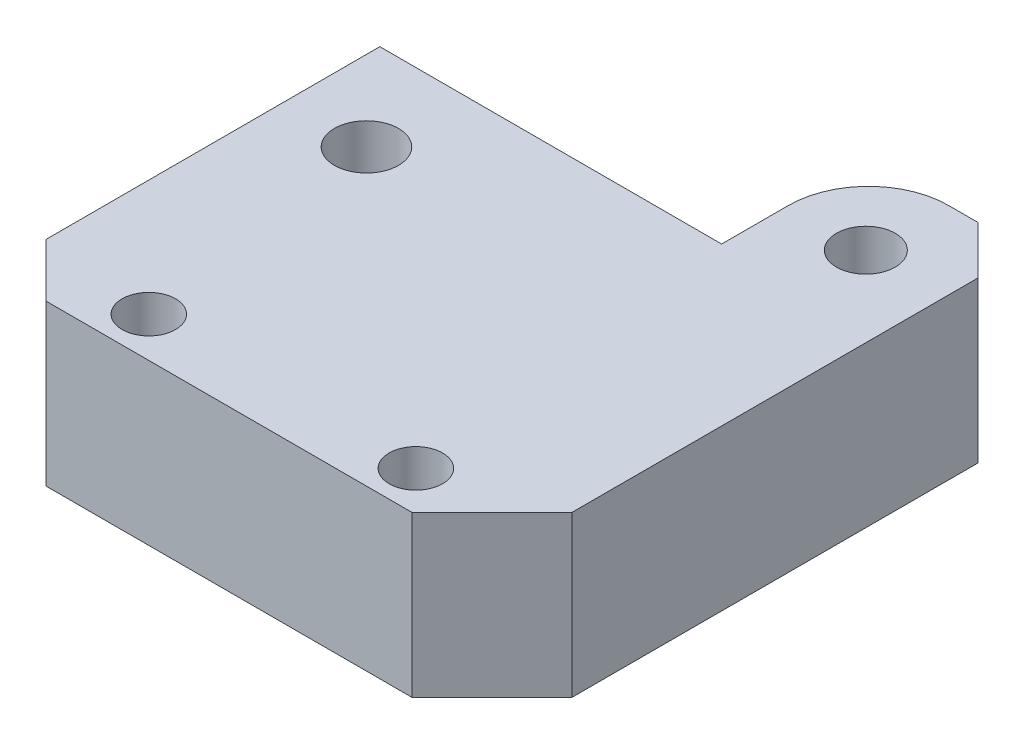
from build123d import *

# Parameters (mm, degrees)
BOSS_EXTRUDE1_DEPTH   = 6
SKETCH2_W             = 12.8
SKETCH2_H             = 5.1
CUT_EXTRUDE1_DEPTH    = 142.370753694
F_1_CLEARANCE_HOLE1_D = 2
F_2_CLEARANCE_HOLE1_D = 2.4
F_1_CLEARANCE_HOLE2_D = 2.2
CHAMFER1_SIZE         = 0.4
CHAMFER2_SIZE         = 3
CHAMFER3_SIZE         = 2
FILLET1_R             = 3


with BuildPart() as part:
    # Sketch1 → Boss-Extrude1 (new body)
    with BuildSketch(Plane(origin=(0, 6, 0), x_dir=(1, 0, 0), z_dir=(0, 1, 0))):
        Polygon((16.9, -120), (0, -120), (0, -140), (18.7, -140), (18.7, -121.8), align=None)
    extrude(amount=-BOSS_EXTRUDE1_DEPTH)

    # Sketch2 → Cut-Extrude1 (cut, through all)
    with BuildSketch(Plane.XZ):
        with Locations((6.4, 122.55)):
            Rectangle(SKETCH2_W, SKETCH2_H)
    extrude(amount=-CUT_EXTRUDE1_DEPTH, mode=Mode.SUBTRACT)

    # #1 Clearance Hole1 (through all)
    with Locations(Plane(origin=(0, 6, 0), x_dir=(1, 0, 0), z_dir=(0, 1, 0))):
        with Locations((14.35, -138.5), (4.35, -138.5)):
            Hole(F_1_CLEARANCE_HOLE1_D / 2)

    # #2 Clearance Hole1 (through all)
    with Locations(Plane(origin=(0, 6, 0), x_dir=(1, 0, 0), z_dir=(0, 1, 0))):
        with Locations((3, -129)):
            Hole(F_2_CLEARANCE_HOLE1_D / 2)

    # #1 Clearance Hole2 (through all)
    with Locations(Plane(origin=(0, 6, 0), x_dir=(1, 0, 0), z_dir=(0, 1, 0))):
        with Locations((15.7, -123)):
            Hole(F_1_CLEARANCE_HOLE2_D / 2)

    # Chamfer1
    chamfer1_edges = [part.edges().sort_by_distance(p)[0] for p in [
        (6.4, 6, 125.1),
        (6.4, 0, 125.1),
    ]]
    chamfer(chamfer1_edges, length=CHAMFER1_SIZE)

    # Chamfer2
    chamfer2_edges = [part.edges().sort_by_distance(p)[0] for p in [
        (18.7, 3, 140),
    ]]
    chamfer(chamfer2_edges, length=CHAMFER2_SIZE)

    # Chamfer3
    chamfer3_edges = [part.edges().sort_by_distance(p)[0] for p in [
        (0, 3, 140),
    ]]
    chamfer(chamfer3_edges, length=CHAMFER3_SIZE)

    # Fillet1
    fillet1_edges = [part.edges().sort_by_distance(p)[0] for p in [
        (12.8, 3, 120),
    ]]
    fillet(fillet1_edges, radius=FILLET1_R)


solid = part.part
